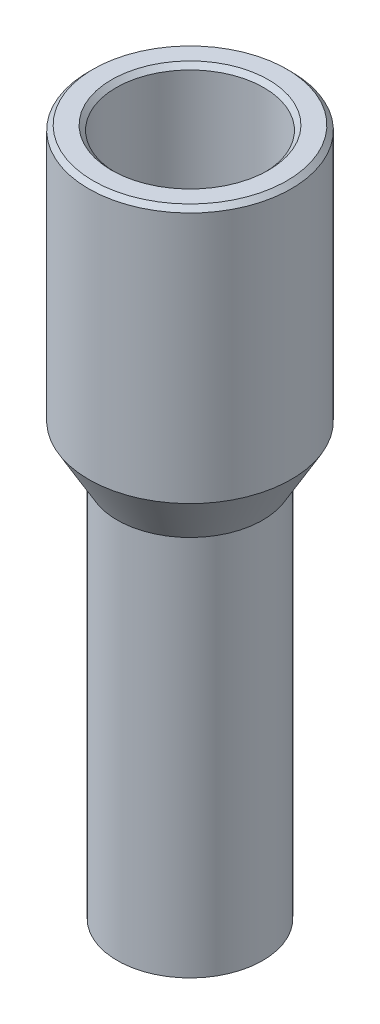
from build123d import *

# Parameters (mm, degrees)
CHAMFER1_SIZE = 0.4


with BuildPart() as part:
    # Sketch1 → Revolve1 (revolve)
    with BuildSketch(Plane.XY, mode=Mode.PRIVATE) as revolve1_sk:
        Polygon((0, 0), (0, 40), (6.45, 40), (6.45, 60), (8.85, 60), (8.85, 37.628649647), (6.35, 33.298522628), (6.35, 0), align=None)
    revolve(revolve1_sk.sketch.rotate(Axis((0, 0, 0), (0, 1, 0)), 90), axis=Axis((0, 0, 0), (0, 1, 0)))

    # Chamfer1
    chamfer1_edges = [part.edges().sort_by_distance(p)[0] for p in [
        (0, 60, 8.85),
        (0, 60, 6.45),
    ]]
    chamfer(chamfer1_edges, length=CHAMFER1_SIZE)


solid = part.part
